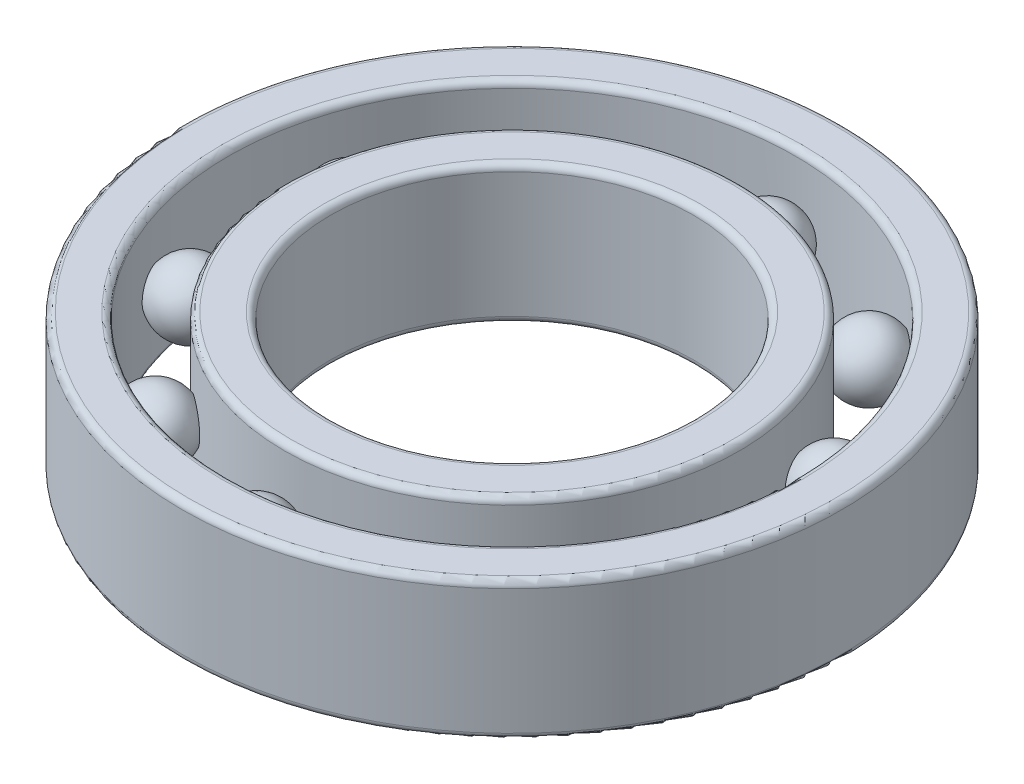
from build123d import *

# Parameters (mm, degrees)
SKETCH_1_R               = 50
SKETCH_1_R_2             = 43
EXTRUDE_2_DEPTH          = 10.5
SKETCH_1_R_3             = 34.5
SKETCH_1_R_4             = 27.5
EXTRUDE_2_2_DEPTH        = 10.5
FILLET_1_R               = 1
FILLET_2_R               = 1
PATTERN_CIRCULAR_1_COUNT = 10


with BuildPart() as part:
    # ｽｹｯﾁ1 → ﾎﾞｽ - 押し出し2 (new, symmetric)
    with BuildSketch(Plane(origin=(0, 0, 0), x_dir=(1, 0, 0), z_dir=(0, 1, 0))):
        with Locations(Location((0, 0, 0), (0, 0, 90))):
            Circle(SKETCH_1_R)
        with Locations(Location((0, 0, 0), (0, 0, 90))):
            Circle(SKETCH_1_R_2, mode=Mode.SUBTRACT)
    extrude(amount=EXTRUDE_2_DEPTH, both=True)

    # ﾌｨﾚｯﾄ1
    fillet_1_edges = [part.edges().sort_by_distance(p)[0] for p in [
        (0, 10.5, 50),
        (0, -10.5, 50),
        (0, -10.5, 43),
        (0, 10.5, 43),
    ]]
    fillet(fillet_1_edges, radius=FILLET_1_R)



with BuildPart() as body_2:
    # ｽｹｯﾁ1 → Extrude 2 2 (new, symmetric)
    with BuildSketch(Plane(origin=(0, 0, 0), x_dir=(1, 0, 0), z_dir=(0, 1, 0))):
        with Locations(Location((0, 0, 0), (0, 0, 90))):
            Circle(SKETCH_1_R_3)
        with Locations(Location((0, 0, 0), (0, 0, 90))):
            Circle(SKETCH_1_R_4, mode=Mode.SUBTRACT)
    extrude(amount=EXTRUDE_2_2_DEPTH, both=True)

    # ﾌｨﾚｯﾄ2
    fillet_2_edges = [body_2.edges().sort_by_distance(p)[0] for p in [
        (0, 10.5, 34.5),
        (0, -10.5, 34.5),
        (0, -10.5, 27.5),
        (0, 10.5, 27.5),
    ]]
    fillet(fillet_2_edges, radius=FILLET_2_R)


with BuildPart() as part_1:
    add(part.part)

    add(body_2.part)  # 回転2 merges body 2
    # ｽｹｯﾁ2 → 回転2 (revolve)
    with BuildSketch(Plane(origin=(0, 0, 0), x_dir=(1, 0, 0), z_dir=(0, 1, 0))):
        with BuildLine():
            Line((0, 33.5), (0, 44))
            ThreePointArc((0, 44), (5.25, 38.75), (0, 33.5))
        make_face()
    revolve_2 = revolve(axis=Axis((0, 0, -34.5), (0, 0, -1)))

    # 円形ﾊﾟﾀｰﾝ1: 回転2 ×10 about axis
    pattern_circular_1_axis = Axis((0, 0, 0), (0, 1, 0))
    for i in range(1, PATTERN_CIRCULAR_1_COUNT):
        add(revolve_2.rotate(pattern_circular_1_axis, i * 360 / PATTERN_CIRCULAR_1_COUNT))


solid = part_1.part
